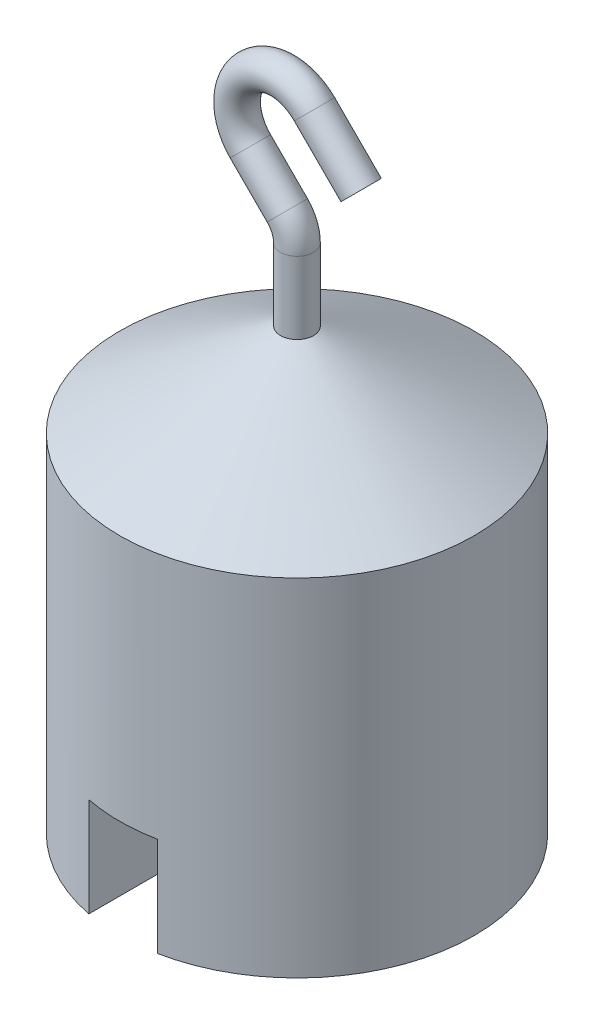
from build123d import *

# Parameters (mm, degrees)
SKETCH2_R               = 2
CUT_EXTRUDE1_DEPTH      = 94.938434637
CUT_EXTRUDE1_DEPTH_BACK = 94.938434637
SKETCH10_W              = 8.3
SKETCH10_H              = 12
BOSS_EXTRUDE1_REACH     = 89.369
SKETCH11_R              = 1.5
SKETCH13_W              = 15
SKETCH13_H              = 6
CUT_EXTRUDE2_DEPTH      = 1.25
CUT_EXTRUDE3_DEPTH      = 0.5


with BuildPart() as part:
    # Sketch1 → Revolve1 (revolve)
    with BuildSketch(Plane.XY):
        Polygon((0, 0), (0, 42), (19.5, 53.258330249), (21.5, 53.258330249), (21.5, 0), align=None)
    revolve(axis=Axis((21.5, 53.258330249, 0), (0, -1, 0)))

    # Sweep6: sweep along a path in Sketch3
    with BuildLine(Plane.XY) as sweep6_path:
        Line((29.278174593, 71.436504842), (23.621320344, 77.093359092))
        ThreePointArc((23.621320344, 77.093359092), (15.843145751, 77.093359092), (15.843145751, 69.315184499))
        Line((15.843145751, 69.315184499), (20.328427125, 64.829903124))
        ThreePointArc((20.328427125, 64.829903124), (21.19551813, 63.532209729), (21.5, 62.001476))
        Line((21.5, 62.001476), (21.5, 53.258330249))
    # Sketch2 → Sweep6 (sweep)
    with BuildSketch(Plane(origin=(0, 53.258330249, 0), x_dir=(1, 0, 0), z_dir=(0, 1, 0))):
        with Locations((21.5, 0)):
            Circle(SKETCH2_R)
    sweep(path=sweep6_path.line)

    # Sketch10 → Cut-Extrude1 (cut, two sides: drawn at the far end of the back side and taken through both)
    with BuildSketch(Plane.XY.offset(-CUT_EXTRUDE1_DEPTH_BACK)):
        with Locations((21.5, 6)):
            Rectangle(SKETCH10_W, SKETCH10_H)
    extrude(amount=CUT_EXTRUDE1_DEPTH + CUT_EXTRUDE1_DEPTH_BACK, mode=Mode.SUBTRACT)

    # Sketch11 → Boss-Extrude1 (add, up to next)
    with BuildSketch(Plane.ZY.offset(-25.65), mode=Mode.PRIVATE) as boss_extrude1_sk1:
        with Locations(Location((0, 4.5, 0), (0, 0, 180))):
            Circle(SKETCH11_R)
    boss_extrude1_tool1 = extrude(boss_extrude1_sk1.sketch, amount=BOSS_EXTRUDE1_REACH, mode=Mode.PRIVATE) - part.part
    add(boss_extrude1_tool1.solids().sort_by_distance((25.65, 4.5, 0))[0])

    # Sketch13 → Cut-Extrude2 (cut)
    with BuildSketch(Plane.ZY):
        with Locations((0, 30)):
            Rectangle(SKETCH13_W, SKETCH13_H)
    extrude(amount=-CUT_EXTRUDE2_DEPTH, mode=Mode.SUBTRACT)

    # Sketch14 → Cut-Extrude3 (cut)
    # profile 1 of 4: a face of its own
    with BuildSketch(Plane.ZY.offset(-1.25)):
        with BuildLine():
            Line((-1.705128205, 31.5), (-1.705128205, 31.141025641))
            Line((-1.705128205, 31.141025641), (-2.895633013, 31.141025641))
            Line((-2.895633013, 31.141025641), (-3.084234776, 30.220452724))
            add(Edge.make_bspline(
                [(-3.084234776, 30.220452724), (-3.047178901, 30.230682996), (-2.975389005, 30.25050253), (-2.869429144, 30.2725083), (-2.768836941, 30.285773744), (-2.703561571, 30.287585055), (-2.67197516, 30.288461538)],
                knots=[0, 0, 0, 0, 1.100273476, 2.13160584, 3.095893838, 4, 4, 4, 4], degree=3))
            add(Edge.make_bspline(
                [(-2.67197516, 30.288461538), (-2.632891421, 30.287615603), (-2.556043023, 30.285952282), (-2.443604076, 30.269980432), (-2.336271183, 30.244840518), (-2.234268813, 30.209719996), (-2.137408262, 30.164810263), (-2.046580701, 30.108710322), (-1.960422788, 30.043176991), (-1.880480194, 29.967831979), (-1.807955886, 29.884910363), (-1.744189896, 29.795752492), (-1.690027306, 29.701224829), (-1.646466551, 29.600424221), (-1.611682216, 29.494465067), (-1.588530222, 29.382232485), (-1.573113513, 29.264784365), (-1.571391126, 29.184479795), (-1.570512821, 29.143529647)],
                knots=[0, 0, 0, 0, 1.052922333, 2.070308379, 3.05430497, 4.020497103, 4.973039431, 5.925935799, 6.892292201, 7.88610001, 8.88166317, 9.857072816, 10.836096531, 11.812156883, 12.81219415, 13.836441305, 14.89672472, 16, 16, 16, 16], degree=3))
            add(Edge.make_bspline(
                [(-1.570512821, 29.143529647), (-1.571177896, 29.115007427), (-1.572499058, 29.05834844), (-1.579217646, 28.974204239), (-1.592153362, 28.891841406), (-1.609521086, 28.811249014), (-1.632063504, 28.732579642), (-1.659352558, 28.655608114), (-1.692748586, 28.580813507), (-1.729379961, 28.507488112), (-1.770626439, 28.437289605), (-1.816404946, 28.371640618), (-1.864770437, 28.309556337), (-1.916811823, 28.251702604), (-1.973012818, 28.198459586), (-2.032692785, 28.149511304), (-2.095375504, 28.104029974), (-2.162030746, 28.063861779), (-2.231173229, 28.026898823), (-2.303801446, 27.996575285), (-2.378262147, 27.969464757), (-2.455627022, 27.94785523), (-2.535720835, 27.930922675), (-2.618675611, 27.919422075), (-2.704056281, 27.911045637), (-2.761931293, 27.91052128), (-2.791165865, 27.91025641)],
                knots=[0, 0, 0, 0, 1.056347294, 2.098418968, 3.122841568, 4.141288669, 5.149314143, 6.15115421, 7.162517403, 8.180376062, 9.185164535, 10.17417709, 11.141909838, 12.097768115, 13.052685741, 14.0056014, 14.954263652, 15.917497458, 16.885230207, 17.854509472, 18.828990115, 19.81800267, 20.826176721, 21.857883937, 22.917946725, 24, 24, 24, 24], degree=3))
            add(Edge.make_bspline(
                [(-2.791165865, 27.91025641), (-2.826040046, 27.910947248), (-2.894650877, 27.91230639), (-2.995171444, 27.926524876), (-3.09188605, 27.946888792), (-3.184016151, 27.977525062), (-3.272387414, 28.015912357), (-3.355810132, 28.064428528), (-3.436415908, 28.119407632), (-3.510927945, 28.184287985), (-3.580084058, 28.255203667), (-3.641990567, 28.332161308), (-3.697124144, 28.41389075), (-3.744601891, 28.500788904), (-3.785099912, 28.592627435), (-3.816914901, 28.689750436), (-3.842593256, 28.79165044), (-3.853456676, 28.86180395), (-3.858974359, 28.897435897)],
                knots=[0, 0, 0, 0, 1.0467383, 2.05933395, 3.04377827, 4.011590433, 4.970194871, 5.932262533, 6.905835911, 7.896367577, 8.894135286, 9.877477877, 10.858688626, 11.851381753, 12.8477658, 13.868841284, 14.917554742, 16, 16, 16, 16], degree=3))
            Line((-3.858974359, 28.897435897), (-3.544871795, 28.897435897))
            add(Edge.make_bspline(
                [(-3.544871795, 28.897435897), (-3.537143237, 28.864059445), (-3.522288521, 28.79990805), (-3.489682772, 28.709776709), (-3.449816897, 28.629457485), (-3.402412548, 28.557887902), (-3.345862518, 28.495478905), (-3.281333089, 28.439861843), (-3.208985366, 28.389686713), (-3.128592136, 28.347863946), (-3.043779057, 28.312195193), (-2.955011847, 28.288443498), (-2.8647075, 28.271742605), (-2.80362913, 28.270070844), (-2.772936699, 28.269230769)],
                knots=[0, 0, 0, 0, 1.136247022, 2.183929868, 3.172523383, 4.106158343, 5.02341133, 5.958108904, 6.928429099, 7.938127109, 8.96079061, 9.975095812, 10.982467395, 12, 12, 12, 12], degree=3))
            add(Edge.make_bspline(
                [(-2.772936699, 28.269230769), (-2.742978254, 28.270051547), (-2.683989832, 28.271667666), (-2.597178445, 28.284106678), (-2.513365571, 28.303264249), (-2.433378214, 28.331934104), (-2.355816675, 28.366778822), (-2.282642904, 28.411493898), (-2.211740027, 28.462953917), (-2.145311894, 28.521910547), (-2.084472445, 28.586880241), (-2.030716323, 28.656357635), (-1.98593941, 28.730474481), (-1.948205301, 28.807947634), (-1.919552002, 28.889626191), (-1.899111021, 28.975127366), (-1.887107962, 29.064662347), (-1.885456782, 29.125731656), (-1.884615385, 29.156850962)],
                knots=[0, 0, 0, 0, 1.027316725, 2.022795036, 3.002884548, 3.971462791, 4.93288096, 5.914575861, 6.907176829, 7.935150275, 8.956128384, 9.956726525, 10.942570165, 11.921478529, 12.907843606, 13.90538589, 14.932640048, 16, 16, 16, 16], degree=3))
            add(Edge.make_bspline(
                [(-1.884615385, 29.156850962), (-1.885273864, 29.184926713), (-1.886562744, 29.239881002), (-1.897093314, 29.320280209), (-1.915410287, 29.396353251), (-1.940834167, 29.468467485), (-1.973113674, 29.536690927), (-2.012559987, 29.601093987), (-2.059913385, 29.660827821), (-2.114005273, 29.715920374), (-2.173263314, 29.766765249), (-2.238707057, 29.810109336), (-2.308966983, 29.846573253), (-2.383196583, 29.878041252), (-2.463161482, 29.900641997), (-2.547278114, 29.917609882), (-2.636454822, 29.927425245), (-2.69742551, 29.928787134), (-2.728766026, 29.929487179)],
                knots=[0, 0, 0, 0, 1.045622112, 2.046656509, 3.013763289, 3.955457236, 4.890082067, 5.820317437, 6.762574623, 7.722996705, 8.69280354, 9.665887285, 10.63943826, 11.638615906, 12.663482002, 13.728887084, 14.832589034, 16, 16, 16, 16], degree=3))
            add(Edge.make_bspline(
                [(-2.728766026, 29.929487179), (-2.755894954, 29.928906588), (-2.81190931, 29.927707815), (-2.897832137, 29.918881318), (-2.988123859, 29.904642024), (-3.082438355, 29.885055776), (-3.181058863, 29.859424699), (-3.283777264, 29.828710199), (-3.39080953, 29.7919882), (-3.462927255, 29.764255986), (-3.5, 29.75)],
                knots=[0, 0, 0, 0, 0.817624296, 1.688186739, 2.600797293, 3.572016777, 4.590301741, 5.671205678, 6.80286297, 8, 8, 8, 8], degree=3))
            Line((-3.5, 29.75), (-3.141025641, 31.5))
            Line((-3.141025641, 31.5), (-1.705128205, 31.5))
        make_face()
    # profile 2 of 4: a face of its own
    with BuildSketch(Plane.ZY.offset(-1.25)):
        with BuildLine():
            add(Edge.make_bspline(
                [(-1.211538462, 29.748597756), (-1.211210443, 29.804695144), (-1.210573263, 29.913665128), (-1.203484842, 30.07244977), (-1.1917095, 30.221410059), (-1.175572127, 30.360553125), (-1.155934147, 30.48991489), (-1.12971866, 30.609149647), (-1.099905858, 30.718809254), (-1.065353412, 30.819251302), (-1.026365623, 30.911829005), (-0.983931362, 30.998254207), (-0.936366568, 31.078396139), (-0.886389655, 31.153533929), (-0.831977583, 31.222437624), (-0.774678793, 31.286080287), (-0.712256917, 31.342991037), (-0.646833908, 31.394837339), (-0.577817444, 31.440286811), (-0.507174778, 31.48031955), (-0.434419672, 31.514519417), (-0.359353489, 31.541409853), (-0.282650931, 31.5636207), (-0.204043864, 31.578809647), (-0.1234025, 31.588366556), (-0.068971066, 31.589280224), (-0.041366186, 31.58974359)],
                knots=[0, 0, 0, 0, 1.646270934, 3.197905019, 4.663502075, 6.030701355, 7.308322542, 8.50163776, 9.611534131, 10.641858119, 11.616356847, 12.558055219, 13.465016945, 14.349605745, 15.204443733, 16.039544428, 16.859896111, 17.680448484, 18.487036065, 19.28249412, 20.06191084, 20.843045899, 21.620316918, 22.403196591, 23.190181807, 24, 24, 24, 24], degree=3))
            add(Edge.make_bspline(
                [(-0.041366186, 31.58974359), (-0.013530707, 31.589255775), (0.041825301, 31.588285664), (0.123665677, 31.578961721), (0.203615358, 31.563490598), (0.281333497, 31.541569623), (0.357458484, 31.514373947), (0.431394891, 31.48028683), (0.503601973, 31.440607962), (0.57293226, 31.393984085), (0.640146876, 31.342001809), (0.703594839, 31.28323914), (0.763281925, 31.218289421), (0.81995723, 31.147847557), (0.872012827, 31.070562472), (0.921586259, 30.987778362), (0.965958295, 30.898047497), (1.008692971, 30.80286703), (1.045579957, 30.699603371), (1.078846203, 30.58883861), (1.105725171, 30.469264423), (1.128114443, 30.341508178), (1.145459339, 30.205100695), (1.158091981, 30.060334379), (1.164765067, 29.907113989), (1.166021768, 29.80235614), (1.166666667, 29.748597756)],
                knots=[0, 0, 0, 0, 0.810914788, 1.612654377, 2.396697861, 3.181598691, 3.963628158, 4.749916497, 5.551656086, 6.361998678, 7.18212741, 8.025565596, 8.878627764, 9.750805457, 10.657531673, 11.591944965, 12.560506719, 13.57287815, 14.630710178, 15.753379473, 16.941251878, 18.199788006, 19.531962791, 20.947069417, 22.433333509, 24, 24, 24, 24], degree=3))
            add(Edge.make_bspline(
                [(1.166666667, 29.748597756), (1.166015082, 29.695073848), (1.164745496, 29.590784697), (1.158166789, 29.438253721), (1.145208158, 29.294255678), (1.12899817, 29.158445216), (1.106547207, 29.031387597), (1.078942041, 28.912643148), (1.048291718, 28.801699077), (1.010456924, 28.699464265), (0.969046213, 28.604512542), (0.923991017, 28.515845394), (0.875721191, 28.432679101), (0.823132446, 28.355679354), (0.767079033, 28.284300697), (0.706361244, 28.219803074), (0.642690659, 28.160632402), (0.575278243, 28.107980775), (0.504866692, 28.06189597), (0.432907615, 28.02068212), (0.358124232, 27.987449425), (0.282211279, 27.958914384), (0.204082913, 27.937113932), (0.123836522, 27.922040077), (0.041880286, 27.911468228), (-0.013521279, 27.910661748), (-0.041366186, 27.91025641)],
                knots=[0, 0, 0, 0, 1.561518951, 3.042555995, 4.452378317, 5.7783523, 7.031515105, 8.214008947, 9.334062868, 10.386615937, 11.391082383, 12.354592575, 13.286541444, 14.194233754, 15.072674879, 15.931287219, 16.775624067, 17.606195743, 18.42308326, 19.229000347, 20.022332153, 20.807536673, 21.593273796, 22.3848459, 23.188221202, 24, 24, 24, 24], degree=3))
            add(Edge.make_bspline(
                [(-0.041366186, 27.91025641), (-0.0689703, 27.910722766), (-0.123400225, 27.911642328), (-0.20405265, 27.921156059), (-0.282335094, 27.936451562), (-0.358633848, 27.957868166), (-0.433340363, 27.984083003), (-0.505436649, 28.018236686), (-0.575724333, 28.057570755), (-0.644015889, 28.102366177), (-0.70902805, 28.15368786), (-0.771126655, 28.210452149), (-0.828751674, 28.27407556), (-0.88238577, 28.343553483), (-0.933359858, 28.418246725), (-0.980249232, 28.499175098), (-1.023620086, 28.586017709), (-1.063263576, 28.67933562), (-1.09841224, 28.780490547), (-1.129459948, 28.890639726), (-1.153974105, 29.010755362), (-1.174957061, 29.139872729), (-1.191881444, 29.278546659), (-1.203435769, 29.426852438), (-1.210577084, 29.584697647), (-1.211212155, 29.692967421), (-1.211538462, 29.748597756)],
                knots=[0, 0, 0, 0, 0.810891512, 1.598919785, 2.382837074, 3.152667961, 3.926044502, 4.706494248, 5.493654104, 6.291793342, 7.103789334, 7.925228297, 8.761435821, 9.622817696, 10.50288917, 11.416980706, 12.369136599, 13.353924996, 14.394355917, 15.514179734, 16.714354668, 17.994756427, 19.357759367, 20.818452758, 22.365282078, 24, 24, 24, 24], degree=3))
        make_face()
        with BuildLine():
            add(Edge.make_bspline(
                [(-0.897435897, 29.75), (-0.89731645, 29.703251301), (-0.897084627, 29.612521256), (-0.891028426, 29.480677995), (-0.882778194, 29.357707667), (-0.872136897, 29.24345413), (-0.856333949, 29.138304118), (-0.838627161, 29.041534435), (-0.817079071, 28.953657197), (-0.791584053, 28.874069387), (-0.762544957, 28.801420318), (-0.730839093, 28.733819103), (-0.69677837, 28.670467167), (-0.658659219, 28.611933558), (-0.617144156, 28.558027394), (-0.573170897, 28.507794562), (-0.525098313, 28.462997581), (-0.45859457, 28.409270726), (-0.370798096, 28.353751592), (-0.260177641, 28.305405502), (-0.14650919, 28.275023046), (-0.06935794, 28.27115929), (-0.030849359, 28.269230769)],
                knots=[0, 0, 0, 0, 1.459021318, 2.831673884, 4.118529203, 5.306027144, 6.411944654, 7.436330062, 8.375795394, 9.233974572, 10.042671642, 10.816086306, 11.563610507, 12.285937304, 12.993564865, 13.685989202, 14.367179055, 15.041617293, 16.353048772, 17.594441528, 18.799311195, 20, 20, 20, 20], degree=3))
            add(Edge.make_bspline(
                [(-0.030849359, 28.269230769), (0.007908313, 28.27082855), (0.085343636, 28.274020813), (0.198477431, 28.30481955), (0.308307701, 28.35128909), (0.394379641, 28.406236595), (0.459862185, 28.458564925), (0.506779175, 28.503179573), (0.549841223, 28.55313544), (0.590683298, 28.607034736), (0.628142374, 28.66590722), (0.662205512, 28.729469796), (0.693288859, 28.797898973), (0.710997905, 28.845668713), (0.720052083, 28.870092147)],
                knots=[0, 0, 0, 0, 1.353760809, 2.704726607, 4.075137775, 5.516104923, 6.260822281, 7.007110065, 7.778089737, 8.566572457, 9.372053459, 10.217411131, 11.088608312, 12, 12, 12, 12], degree=3))
            add(Edge.make_bspline(
                [(0.720052083, 28.870092147), (0.730603851, 28.901321887), (0.752028465, 28.964731651), (0.779640239, 29.063095303), (0.801385638, 29.166298067), (0.820949004, 29.273723184), (0.83430206, 29.386162885), (0.845049873, 29.503269269), (0.85138056, 29.625130631), (0.852165311, 29.707925622), (0.852564103, 29.75)],
                knots=[0, 0, 0, 0, 0.884706709, 1.796334032, 2.740027952, 3.714592787, 4.726048262, 5.777819803, 6.87074269, 8, 8, 8, 8], degree=3))
            add(Edge.make_bspline(
                [(0.852564103, 29.75), (0.852013913, 29.792067573), (0.850937626, 29.874360737), (0.846823638, 29.994878918), (0.836200063, 30.109346679), (0.824400945, 30.218257152), (0.807003723, 30.321007454), (0.788245917, 30.418457759), (0.763044704, 30.509400784), (0.736124929, 30.595260366), (0.705314534, 30.675061021), (0.671398799, 30.749174807), (0.635177041, 30.817959532), (0.5958348, 30.881226473), (0.553839117, 30.939259016), (0.508081568, 30.990893611), (0.460377195, 31.037730579), (0.393560009, 31.091193148), (0.30608572, 31.145704843), (0.197240072, 31.195870603), (0.083969428, 31.224678896), (0.007395974, 31.228740583), (-0.030849359, 31.230769231)],
                knots=[0, 0, 0, 0, 1.31362396, 2.569729283, 3.763502607, 4.902122613, 5.988968491, 7.01645872, 7.998833611, 8.933434873, 9.825090667, 10.667526885, 11.477055099, 12.250526234, 12.991942729, 13.710640831, 14.402115721, 15.076753259, 16.378508321, 17.609869233, 18.806226677, 20, 20, 20, 20], degree=3))
            add(Edge.make_bspline(
                [(-0.030849359, 31.230769231), (-0.069559951, 31.228737784), (-0.147051657, 31.22467119), (-0.261499611, 31.195977936), (-0.371203963, 31.14596497), (-0.458446938, 31.091012598), (-0.525310724, 31.038674287), (-0.572393418, 30.993287833), (-0.61653959, 30.943641578), (-0.65720729, 30.889239663), (-0.695296573, 30.830774296), (-0.730277586, 30.767785531), (-0.761794915, 30.699954167), (-0.790879452, 30.627337732), (-0.81645224, 30.547756787), (-0.837546203, 30.459987794), (-0.857033256, 30.363525902), (-0.870828525, 30.257806394), (-0.883092281, 30.14352424), (-0.890973629, 30.020246922), (-0.897104886, 29.888182542), (-0.89732335, 29.796983383), (-0.897435897, 29.75)],
                knots=[0, 0, 0, 0, 1.207732386, 2.417664972, 3.655092373, 4.956220595, 5.625982001, 6.301752483, 6.994047911, 7.697131622, 8.419323945, 9.170223765, 9.943494443, 10.752040957, 11.610060368, 12.549350801, 13.567764191, 14.679664412, 15.874934091, 17.154273443, 18.533957287, 20, 20, 20, 20], degree=3))
        make_face(mode=Mode.SUBTRACT)
    # profile 3 of 4: a face of its own
    with BuildSketch(Plane.ZY.offset(-1.25)):
        with BuildLine():
            add(Edge.make_bspline(
                [(1.480769231, 29.748597756), (1.481097249, 29.804695144), (1.481734429, 29.913665128), (1.48882285, 30.07244977), (1.500598192, 30.221410059), (1.516735565, 30.360553125), (1.536373545, 30.48991489), (1.562589032, 30.609149647), (1.592401834, 30.718809254), (1.62695428, 30.819251302), (1.665942069, 30.911829005), (1.70837633, 30.998254207), (1.755941124, 31.078396139), (1.805918037, 31.153533929), (1.860330109, 31.222437624), (1.917628899, 31.286080287), (1.980050776, 31.342991037), (2.045473784, 31.394837339), (2.114490248, 31.440286811), (2.185132915, 31.48031955), (2.25788802, 31.514519417), (2.332954203, 31.541409853), (2.409656761, 31.5636207), (2.488263828, 31.578809647), (2.568905192, 31.588366556), (2.623336627, 31.589280224), (2.650941506, 31.58974359)],
                knots=[0, 0, 0, 0, 1.646270934, 3.197905019, 4.663502075, 6.030701355, 7.308322542, 8.50163776, 9.611534131, 10.641858119, 11.616356847, 12.558055219, 13.465016945, 14.349605745, 15.204443733, 16.039544428, 16.859896111, 17.680448484, 18.487036065, 19.28249412, 20.06191084, 20.843045899, 21.620316918, 22.403196591, 23.190181807, 24, 24, 24, 24], degree=3))
            add(Edge.make_bspline(
                [(2.650941506, 31.58974359), (2.678776985, 31.589255775), (2.734132994, 31.588285664), (2.815973369, 31.578961721), (2.895923051, 31.563490598), (2.973641189, 31.541569623), (3.049766176, 31.514373947), (3.123702584, 31.48028683), (3.195909665, 31.440607962), (3.265239953, 31.393984085), (3.332454568, 31.342001809), (3.395902531, 31.28323914), (3.455589617, 31.218289421), (3.512264922, 31.147847557), (3.56432052, 31.070562472), (3.613893952, 30.987778362), (3.658265988, 30.898047497), (3.701000663, 30.80286703), (3.73788765, 30.699603371), (3.771153895, 30.58883861), (3.798032863, 30.469264423), (3.820422136, 30.341508178), (3.837767032, 30.205100695), (3.850399674, 30.060334379), (3.857072759, 29.907113989), (3.85832946, 29.80235614), (3.858974359, 29.748597756)],
                knots=[0, 0, 0, 0, 0.810914788, 1.612654377, 2.396697861, 3.181598691, 3.963628158, 4.749916497, 5.551656086, 6.361998678, 7.18212741, 8.025565596, 8.878627764, 9.750805457, 10.657531673, 11.591944965, 12.560506719, 13.57287815, 14.630710178, 15.753379473, 16.941251878, 18.199788006, 19.531962791, 20.947069417, 22.433333509, 24, 24, 24, 24], degree=3))
            add(Edge.make_bspline(
                [(3.858974359, 29.748597756), (3.858322774, 29.695073848), (3.857053189, 29.590784697), (3.850474482, 29.438253721), (3.837515851, 29.294255678), (3.821305862, 29.158445216), (3.798854899, 29.031387597), (3.771249733, 28.912643148), (3.74059941, 28.801699077), (3.702764616, 28.699464265), (3.661353906, 28.604512542), (3.61629871, 28.515845394), (3.568028883, 28.432679101), (3.515440138, 28.355679354), (3.459386725, 28.284300697), (3.398668937, 28.219803074), (3.334998351, 28.160632402), (3.267585936, 28.107980775), (3.197174384, 28.06189597), (3.125215307, 28.02068212), (3.050431924, 27.987449425), (2.974518971, 27.958914384), (2.896390605, 27.937113932), (2.816144215, 27.922040077), (2.734187979, 27.911468228), (2.678786414, 27.910661748), (2.650941506, 27.91025641)],
                knots=[0, 0, 0, 0, 1.561518951, 3.042555995, 4.452378317, 5.7783523, 7.031515105, 8.214008947, 9.334062868, 10.386615937, 11.391082383, 12.354592575, 13.286541444, 14.194233754, 15.072674879, 15.931287219, 16.775624067, 17.606195743, 18.42308326, 19.229000347, 20.022332153, 20.807536673, 21.593273796, 22.3848459, 23.188221202, 24, 24, 24, 24], degree=3))
            add(Edge.make_bspline(
                [(2.650941506, 27.91025641), (2.623337392, 27.910722766), (2.568907468, 27.911642328), (2.488255042, 27.921156059), (2.409972599, 27.936451562), (2.333673845, 27.957868166), (2.25896733, 27.984083003), (2.186871043, 28.018236686), (2.116583359, 28.057570755), (2.048291803, 28.102366177), (1.983279642, 28.15368786), (1.921181037, 28.210452149), (1.863556018, 28.27407556), (1.809921922, 28.343553483), (1.758947834, 28.418246725), (1.712058461, 28.499175098), (1.668687607, 28.586017709), (1.629044116, 28.67933562), (1.593895452, 28.780490547), (1.562847744, 28.890639726), (1.538333587, 29.010755362), (1.517350632, 29.139872729), (1.500426248, 29.278546659), (1.488871923, 29.426852438), (1.481730608, 29.584697647), (1.481095538, 29.692967421), (1.480769231, 29.748597756)],
                knots=[0, 0, 0, 0, 0.810891512, 1.598919785, 2.382837074, 3.152667961, 3.926044502, 4.706494248, 5.493654104, 6.291793342, 7.103789334, 7.925228297, 8.761435821, 9.622817696, 10.50288917, 11.416980706, 12.369136599, 13.353924996, 14.394355917, 15.514179734, 16.714354668, 17.994756427, 19.357759367, 20.818452758, 22.365282078, 24, 24, 24, 24], degree=3))
        make_face()
        with BuildLine():
            add(Edge.make_bspline(
                [(1.794871795, 29.75), (1.794991242, 29.703251301), (1.795223065, 29.612521256), (1.801279266, 29.480677995), (1.809529498, 29.357707667), (1.820170795, 29.24345413), (1.835973744, 29.138304118), (1.853680531, 29.041534435), (1.875228621, 28.953657197), (1.900723639, 28.874069387), (1.929762736, 28.801420318), (1.961468599, 28.733819103), (1.995529322, 28.670467167), (2.033648473, 28.611933558), (2.075163536, 28.558027394), (2.119136795, 28.507794562), (2.167209379, 28.462997581), (2.233713122, 28.409270726), (2.321509596, 28.353751592), (2.432130052, 28.305405502), (2.545798503, 28.275023046), (2.622949753, 28.27115929), (2.661458333, 28.269230769)],
                knots=[0, 0, 0, 0, 1.459021318, 2.831673884, 4.118529203, 5.306027144, 6.411944654, 7.436330062, 8.375795394, 9.233974572, 10.042671642, 10.816086306, 11.563610507, 12.285937304, 12.993564865, 13.685989202, 14.367179055, 15.041617293, 16.353048772, 17.594441528, 18.799311195, 20, 20, 20, 20], degree=3))
            add(Edge.make_bspline(
                [(2.661458333, 28.269230769), (2.700216005, 28.27082855), (2.777651328, 28.274020813), (2.890785123, 28.30481955), (3.000615393, 28.35128909), (3.086687334, 28.406236595), (3.152169877, 28.458564925), (3.199086867, 28.503179573), (3.242148916, 28.55313544), (3.282990991, 28.607034736), (3.320450066, 28.66590722), (3.354513204, 28.729469796), (3.385596551, 28.797898973), (3.403305597, 28.845668713), (3.412359776, 28.870092147)],
                knots=[0, 0, 0, 0, 1.353760809, 2.704726607, 4.075137775, 5.516104923, 6.260822281, 7.007110065, 7.778089737, 8.566572457, 9.372053459, 10.217411131, 11.088608312, 12, 12, 12, 12], degree=3))
            add(Edge.make_bspline(
                [(3.412359776, 28.870092147), (3.422911543, 28.901321887), (3.444336157, 28.964731651), (3.471947932, 29.063095303), (3.493693331, 29.166298067), (3.513256696, 29.273723184), (3.526609752, 29.386162885), (3.537357566, 29.503269269), (3.543688253, 29.625130631), (3.544473004, 29.707925622), (3.544871795, 29.75)],
                knots=[0, 0, 0, 0, 0.884706709, 1.796334032, 2.740027952, 3.714592787, 4.726048262, 5.777819803, 6.87074269, 8, 8, 8, 8], degree=3))
            add(Edge.make_bspline(
                [(3.544871795, 29.75), (3.544321606, 29.792067573), (3.543245318, 29.874360737), (3.53913133, 29.994878918), (3.528507756, 30.109346679), (3.516708637, 30.218257152), (3.499311416, 30.321007454), (3.480553609, 30.418457759), (3.455352397, 30.509400784), (3.428432622, 30.595260366), (3.397622226, 30.675061021), (3.363706492, 30.749174807), (3.327484733, 30.817959532), (3.288142493, 30.881226473), (3.24614681, 30.939259016), (3.20038926, 30.990893611), (3.152684887, 31.037730579), (3.085867702, 31.091193148), (2.998393412, 31.145704843), (2.889547765, 31.195870603), (2.77627712, 31.224678896), (2.699703666, 31.228740583), (2.661458333, 31.230769231)],
                knots=[0, 0, 0, 0, 1.31362396, 2.569729283, 3.763502607, 4.902122613, 5.988968491, 7.01645872, 7.998833611, 8.933434873, 9.825090667, 10.667526885, 11.477055099, 12.250526234, 12.991942729, 13.710640831, 14.402115721, 15.076753259, 16.378508321, 17.609869233, 18.806226677, 20, 20, 20, 20], degree=3))
            add(Edge.make_bspline(
                [(2.661458333, 31.230769231), (2.622747741, 31.228737784), (2.545256036, 31.22467119), (2.430808081, 31.195977936), (2.321103729, 31.14596497), (2.233860755, 31.091012598), (2.166996968, 31.038674287), (2.119914275, 30.993287833), (2.075768102, 30.943641578), (2.035100402, 30.889239663), (1.997011119, 30.830774296), (1.962030107, 30.767785531), (1.930512777, 30.699954167), (1.901428241, 30.627337732), (1.875855453, 30.547756787), (1.854761489, 30.459987794), (1.835274436, 30.363525902), (1.821479167, 30.257806394), (1.809215412, 30.14352424), (1.801334064, 30.020246922), (1.795202806, 29.888182542), (1.794984342, 29.796983383), (1.794871795, 29.75)],
                knots=[0, 0, 0, 0, 1.207732386, 2.417664972, 3.655092373, 4.956220595, 5.625982001, 6.301752483, 6.994047911, 7.697131622, 8.419323945, 9.170223765, 9.943494443, 10.752040957, 11.610060368, 12.549350801, 13.567764191, 14.679664412, 15.874934091, 17.154273443, 18.533957287, 20, 20, 20, 20], degree=3))
        make_face(mode=Mode.SUBTRACT)
    # profile 4 of 4: a face of its own
    with BuildSketch(Plane.ZY.offset(-1.25)):
        with BuildLine():
            add(Edge.make_bspline(
                [(4.71063496, 30.25748531), (4.710833333, 30.291410873), (4.711218675, 30.357311768), (4.715505482, 30.453338671), (4.72262676, 30.543424179), (4.732386029, 30.627572604), (4.744262331, 30.705805672), (4.760116459, 30.77791431), (4.778146106, 30.844232263), (4.799042109, 30.904975788), (4.822620438, 30.960963256), (4.848283063, 31.013229925), (4.877048438, 31.061696713), (4.907272571, 31.107137186), (4.94017892, 31.148807516), (4.974831045, 31.187296173), (5.012581418, 31.221713627), (5.052146761, 31.253068296), (5.09388529, 31.280554405), (5.136607283, 31.30476468), (5.180606799, 31.325447457), (5.226003967, 31.341709768), (5.272390752, 31.355142042), (5.319929311, 31.364327739), (5.368698136, 31.370107393), (5.401616195, 31.370659945), (5.418310574, 31.370940171)],
                knots=[0, 0, 0, 0, 1.646270934, 3.197905019, 4.663502075, 6.030701355, 7.308322542, 8.50163776, 9.611534131, 10.641858119, 11.616356847, 12.558055219, 13.465016945, 14.349605745, 15.204443733, 16.039544428, 16.859896111, 17.680448484, 18.487036065, 19.28249412, 20.06191084, 20.843045899, 21.620316918, 22.403196591, 23.190181807, 24, 24, 24, 24], degree=3))
            add(Edge.make_bspline(
                [(5.418310574, 31.370940171), (5.435144411, 31.370645159), (5.468621617, 31.370058473), (5.518115558, 31.364419708), (5.56646608, 31.355063362), (5.613467049, 31.341806391), (5.659504541, 31.325359482), (5.704218464, 31.304744892), (5.747886556, 31.280748625), (5.789814873, 31.25255228), (5.830463711, 31.22111538), (5.868834622, 31.185577956), (5.904931098, 31.14629884), (5.939206164, 31.103698284), (5.970687406, 31.056959209), (6.000667529, 31.006894533), (6.027502046, 30.952628725), (6.05334635, 30.895067204), (6.075654194, 30.832617277), (6.095772352, 30.765630969), (6.112027728, 30.693317056), (6.125567907, 30.616054946), (6.13605744, 30.533560896), (6.14369718, 30.446011744), (6.147732808, 30.353349888), (6.148492813, 30.289996332), (6.148882823, 30.25748531)],
                knots=[0, 0, 0, 0, 0.810914788, 1.612654377, 2.396697861, 3.181598691, 3.963628158, 4.749916497, 5.551656086, 6.361998678, 7.18212741, 8.025565596, 8.878627764, 9.750805457, 10.657531673, 11.591944965, 12.560506719, 13.57287815, 14.630710178, 15.753379473, 16.941251878, 18.199788006, 19.531962791, 20.947069417, 22.433333509, 24, 24, 24, 24], degree=3))
            add(Edge.make_bspline(
                [(6.148882823, 30.25748531), (6.14848877, 30.225116089), (6.147720972, 30.162045983), (6.143742421, 30.06980106), (6.135905535, 29.982716529), (6.126102351, 29.900583535), (6.112524864, 29.823743928), (6.095830311, 29.751931809), (6.077294164, 29.684837061), (6.054413121, 29.623009341), (6.029369501, 29.565586156), (6.002121835, 29.511963643), (5.972930083, 29.461667837), (5.941126414, 29.415101324), (5.907227445, 29.371934231), (5.870507639, 29.332928526), (5.832002095, 29.297144358), (5.791233634, 29.265302659), (5.74865141, 29.237432325), (5.705133301, 29.212507758), (5.65990716, 29.19240989), (5.613997898, 29.175152985), (5.566748839, 29.161968902), (5.518218879, 29.152852808), (5.468654869, 29.146459357), (5.435150113, 29.145971629), (5.418310574, 29.145726496)],
                knots=[0, 0, 0, 0, 1.561518951, 3.042555995, 4.452378317, 5.7783523, 7.031515105, 8.214008947, 9.334062868, 10.386615937, 11.391082383, 12.354592575, 13.286541444, 14.194233754, 15.072674879, 15.931287219, 16.775624067, 17.606195743, 18.42308326, 19.229000347, 20.022332153, 20.807536673, 21.593273796, 22.3848459, 23.188221202, 24, 24, 24, 24], degree=3))
            add(Edge.make_bspline(
                [(5.418310574, 29.145726496), (5.401616658, 29.14600853), (5.368699513, 29.146564646), (5.319923998, 29.152318188), (5.272581759, 29.161568326), (5.226439179, 29.174520272), (5.181259524, 29.190374006), (5.137658437, 29.211028853), (5.095151123, 29.2348166), (5.053850992, 29.261907164), (5.014534113, 29.292944563), (4.976979243, 29.327273442), (4.942129826, 29.365750458), (4.909693969, 29.407768059), (4.878866782, 29.452939686), (4.850509875, 29.501882083), (4.824280835, 29.554401186), (4.800305962, 29.610836303), (4.779049389, 29.67201095), (4.760272918, 29.738624977), (4.74544769, 29.811266338), (4.732757997, 29.889351603), (4.722522775, 29.973216313), (4.71553516, 30.062905998), (4.711216364, 30.158364767), (4.710832298, 30.223842202), (4.71063496, 30.25748531)],
                knots=[0, 0, 0, 0, 0.810891512, 1.598919785, 2.382837074, 3.152667961, 3.926044502, 4.706494248, 5.493654104, 6.291793342, 7.103789334, 7.925228297, 8.761435821, 9.622817696, 10.50288917, 11.416980706, 12.369136599, 13.353924996, 14.394355917, 15.514179734, 16.714354668, 17.994756427, 19.357759367, 20.818452758, 22.365282078, 24, 24, 24, 24], degree=3))
        make_face()
        with BuildLine():
            add(Edge.make_bspline(
                [(4.900592225, 30.258333333), (4.900664462, 30.230061501), (4.90080466, 30.175191426), (4.904467219, 30.095457645), (4.909456645, 30.021089875), (4.915892096, 29.951993688), (4.925449118, 29.888402966), (4.936157508, 29.829880349), (4.949188972, 29.776735543), (4.964607388, 29.728603867), (4.982169127, 29.684668478), (5.001343626, 29.643785839), (5.021942253, 29.605473001), (5.044995263, 29.570074104), (5.070101992, 29.53747371), (5.096695344, 29.507094806), (5.125767812, 29.480003299), (5.165986742, 29.447511344), (5.219082705, 29.413935486), (5.285981742, 29.384697613), (5.354724091, 29.366323461), (5.401382228, 29.363986808), (5.42467075, 29.362820513)],
                knots=[0, 0, 0, 0, 1.459021318, 2.831673884, 4.118529203, 5.306027144, 6.411944654, 7.436330062, 8.375795394, 9.233974572, 10.042671642, 10.816086306, 11.563610507, 12.285937304, 12.993564865, 13.685989202, 14.367179055, 15.041617293, 16.353048772, 17.594441528, 18.799311195, 20, 20, 20, 20], degree=3))
            add(Edge.make_bspline(
                [(5.42467075, 29.362820513), (5.448109914, 29.36378679), (5.494939847, 29.365717349), (5.563358857, 29.384343252), (5.62978002, 29.412446259), (5.681833051, 29.445676417), (5.721434398, 29.477322597), (5.749808007, 29.504303837), (5.775850293, 29.534515242), (5.800550024, 29.567111483), (5.823203846, 29.602715319), (5.843803934, 29.641155543), (5.862601959, 29.682538903), (5.873311715, 29.711428221), (5.878787337, 29.726198584)],
                knots=[0, 0, 0, 0, 1.353760809, 2.704726607, 4.075137775, 5.516104923, 6.260822281, 7.007110065, 7.778089737, 8.566572457, 9.372053459, 10.217411131, 11.088608312, 12, 12, 12, 12], degree=3))
            add(Edge.make_bspline(
                [(5.878787337, 29.726198584), (5.885168644, 29.745085141), (5.898125434, 29.783432951), (5.914823984, 29.842919541), (5.927974773, 29.905332641), (5.939805951, 29.970299259), (5.947881371, 30.038298507), (5.954381239, 30.109119986), (5.958209797, 30.182817096), (5.958684384, 30.232888352), (5.958925558, 30.258333333)],
                knots=[0, 0, 0, 0, 0.884706709, 1.796334032, 2.740027952, 3.714592787, 4.726048262, 5.777819803, 6.87074269, 8, 8, 8, 8], degree=3))
            add(Edge.make_bspline(
                [(5.958925558, 30.258333333), (5.958592825, 30.283774199), (5.957941927, 30.33354197), (5.955453944, 30.406426774), (5.949029211, 30.475652515), (5.941893553, 30.54151742), (5.931372377, 30.603656889), (5.920028369, 30.662591121), (5.904787636, 30.717589998), (5.888507582, 30.769514602), (5.869874628, 30.817774998), (5.849363684, 30.862596193), (5.827458145, 30.904194574), (5.803665456, 30.94245601), (5.778268067, 30.977551881), (5.750595644, 31.008778517), (5.721745857, 31.037103731), (5.681337368, 31.069435856), (5.62843625, 31.102402453), (5.562610549, 31.132740793), (5.494108779, 31.150162951), (5.447800071, 31.152619305), (5.42467075, 31.153846154)],
                knots=[0, 0, 0, 0, 1.31362396, 2.569729283, 3.763502607, 4.902122613, 5.988968491, 7.01645872, 7.998833611, 8.933434873, 9.825090667, 10.667526885, 11.477055099, 12.250526234, 12.991942729, 13.710640831, 14.402115721, 15.076753259, 16.378508321, 17.609869233, 18.806226677, 20, 20, 20, 20], degree=3))
            add(Edge.make_bspline(
                [(5.42467075, 31.153846154), (5.401260059, 31.152617612), (5.354396028, 31.150158291), (5.285182264, 31.132805704), (5.218837252, 31.102559768), (5.166076024, 31.069326666), (5.125639353, 31.03767445), (5.097165534, 31.010226451), (5.070467611, 30.980202288), (5.045873335, 30.947302082), (5.022838388, 30.911944455), (5.001683204, 30.87385125), (4.982622724, 30.832829425), (4.965033504, 30.788913771), (4.949568056, 30.740786247), (4.936811231, 30.687706904), (4.925026203, 30.629370426), (4.91668335, 30.565435295), (4.909266698, 30.496321803), (4.904500359, 30.421768377), (4.900792408, 30.341900871), (4.900660289, 30.286747094), (4.900592225, 30.258333333)],
                knots=[0, 0, 0, 0, 1.207732386, 2.417664972, 3.655092373, 4.956220595, 5.625982001, 6.301752483, 6.994047911, 7.697131622, 8.419323945, 9.170223765, 9.943494443, 10.752040957, 11.610060368, 12.549350801, 13.567764191, 14.679664412, 15.874934091, 17.154273443, 18.533957287, 20, 20, 20, 20], degree=3))
        make_face(mode=Mode.SUBTRACT)
    extrude(amount=-CUT_EXTRUDE3_DEPTH, mode=Mode.SUBTRACT)


solid = part.part
